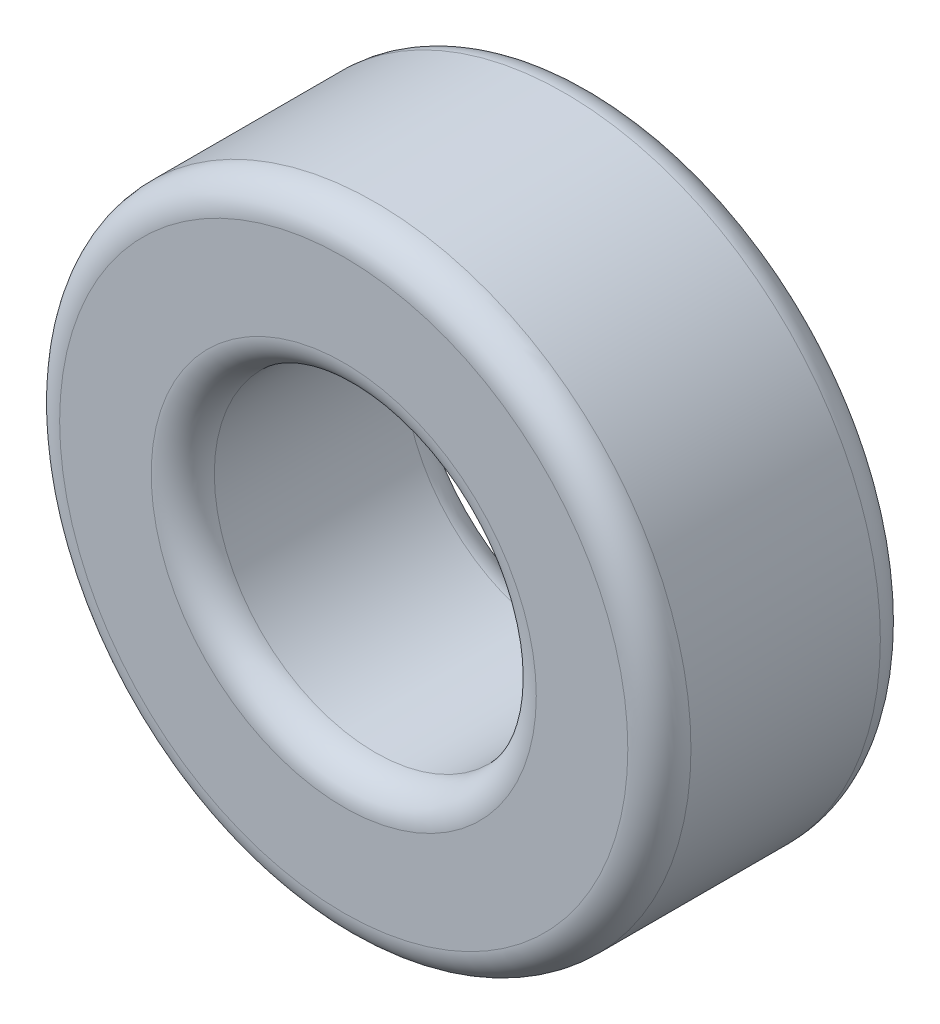
from build123d import *

# Parameters (mm, degrees)
SKETCH1_R           = 12.7
SKETCH1_R_2         = 6.477
BOSS_EXTRUDE1_DEPTH = 10.16
FILLET1_R           = 1.27


with BuildPart() as part:
    # Sketch1 → Boss-Extrude1 (new body)
    with BuildSketch(Plane.XY):
        Circle(SKETCH1_R)
        Circle(SKETCH1_R_2, mode=Mode.SUBTRACT)
    extrude(amount=BOSS_EXTRUDE1_DEPTH)

    # Fillet1
    fillet1_edges = [part.edges().sort_by_distance(p)[0] for p in [
        (-12.7, 0, 0),
        (-12.7, 0, 10.16),
        (-6.477, 0, 0),
        (-6.477, 0, 10.16),
    ]]
    fillet(fillet1_edges, radius=FILLET1_R)


solid = part.part
